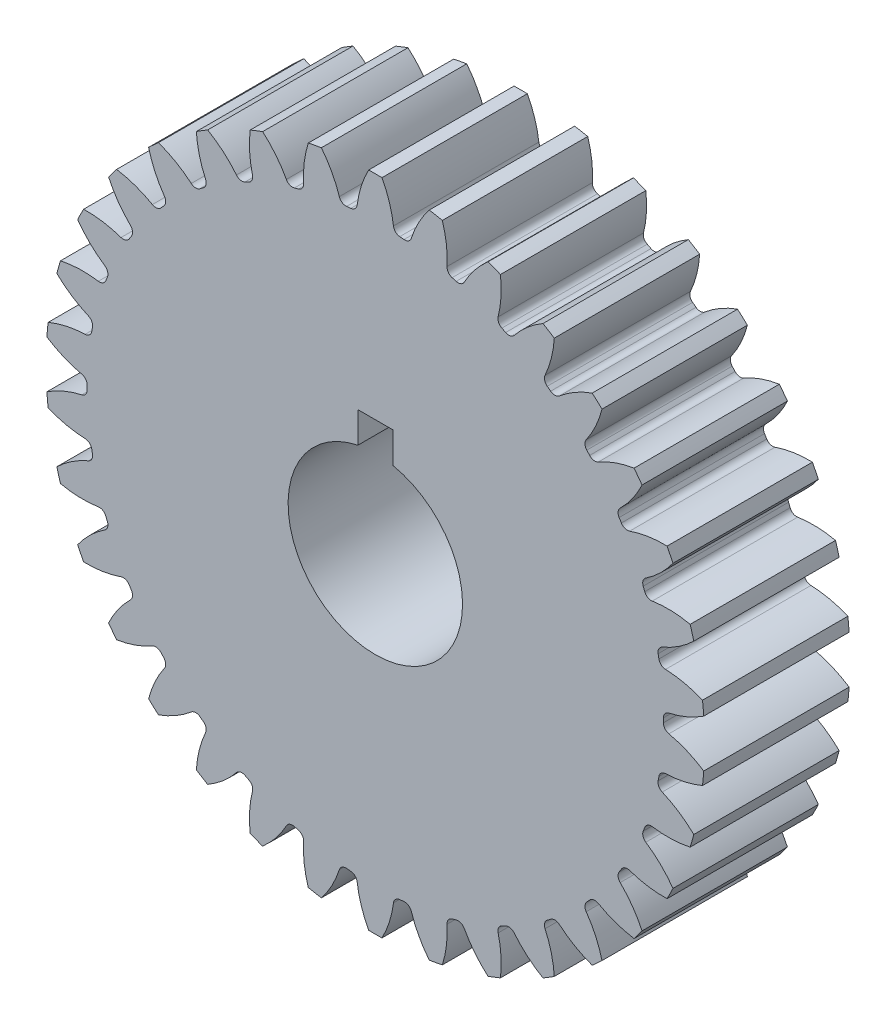
from build123d import *

# Parameters (mm, degrees)
BOSS_EXTRUDE1_DEPTH = 12.5
SKETCH2_R           = 15
CUT_EXTRUDE2_DEPTH  = 84.79598452
SKETCH3_W           = 6
SKETCH3_H           = 20
CUT_EXTRUDE3_DEPTH  = 84.79598452


with BuildPart() as part:
    # Sketch1 → Boss-Extrude1 (new, symmetric)
    with BuildSketch(Plane.XY):
        with BuildLine():
            ThreePointArc((4.20734432, 49.370549967), (3.481701344, 49.698584695), (3.123089937, 50.409613787))
            ThreePointArc((3.123089937, 50.409613787), (2.41504122, 53.603003225), (1.142985889, 56.616463747))
            ThreePointArc((1.142985889, 56.616463747), (0, 56.628), (-1.142985889, 56.616463747))
            ThreePointArc((-1.142985889, 56.616463747), (-2.41504122, 53.603003225), (-3.123089937, 50.409613787))
            ThreePointArc((-3.123089937, 50.409613787), (-3.481701344, 49.698584695), (-4.20734432, 49.370549967))
            ThreePointArc((-4.20734432, 49.370549967), (-4.571851077, 49.338130568), (-4.936108463, 49.303020024))
            ThreePointArc((-4.936108463, 49.303020024), (-5.709672211, 49.49213279), (-6.192828831, 50.125160588))
            ThreePointArc((-6.192828831, 50.125160588), (-7.475605442, 53.134072892), (-9.279723532, 55.862483969))
            ThreePointArc((-9.279723532, 55.862483969), (-10.405367695, 55.663800689), (-11.526772296, 55.442437757))
            ThreePointArc((-11.526772296, 55.442437757), (-12.22344655, 52.246547572), (-12.332655622, 48.977428048))
            ThreePointArc((-12.332655622, 48.977428048), (-12.554509736, 48.212610904), (-13.207521039, 47.756825044))
            ThreePointArc((-13.207521039, 47.756825044), (-13.559864327, 47.657979706), (-13.911467993, 47.556534867))
            ThreePointArc((-13.911467993, 47.556534867), (-14.706609728, 47.600285663), (-15.29785824, 48.133755163))
            ThreePointArc((-15.29785824, 48.133755163), (-17.111679327, 50.855725434), (-19.386423098, 53.206174299))
            ThreePointArc((-19.386423098, 53.206174299), (-20.456393073, 52.804037407), (-21.518028298, 52.380386044))
            ThreePointArc((-21.518028298, 52.380386044), (-21.615597068, 49.110898405), (-21.122247512, 45.877374739))
            ThreePointArc((-21.122247512, 45.877374739), (-21.199789357, 45.084814474), (-21.757931469, 44.516798722))
            ThreePointArc((-21.757931469, 44.516798722), (-22.08611266, 44.354893505), (-22.413089165, 44.190568953))
            ThreePointArc((-22.413089165, 44.190568953), (-23.202731288, 44.087467898), (-23.881937435, 44.503212437))
            ThreePointArc((-23.881937435, 44.503212437), (-26.165035496, 46.845547241), (-28.832941276, 48.737992176))
            ThreePointArc((-28.832941276, 48.737992176), (-29.810800519, 48.146095962), (-30.776513654, 47.534583109))
            ThreePointArc((-30.776513654, 47.534583109), (-30.271654353, 44.302836495), (-29.192546596, 41.215022457))
            ThreePointArc((-29.192546596, 41.215022457), (-29.123135577, 40.42170876), (-29.567401638, 39.760806212))
            ThreePointArc((-29.567401638, 39.760806212), (-29.860244915, 39.541354603), (-30.151459467, 39.319746213))
            ThreePointArc((-30.151459467, 39.319746213), (-30.908711664, 39.073304291), (-31.652745894, 39.357166187))
            ThreePointArc((-31.652745894, 39.357166187), (-34.327372762, 41.240100122), (-37.297588221, 42.610096185))
            ThreePointArc((-37.297588221, 42.610096185), (-38.150036908, 41.848596964), (-38.98694175, 41.070046957))
            ThreePointArc((-38.98694175, 41.070046957), (-37.896846756, 37.986094624), (-36.268728518, 35.149142017))
            ThreePointArc((-36.268728518, 35.149142017), (-36.054728345, 34.382090235), (-36.369989407, 33.650807134))
            ThreePointArc((-36.369989407, 33.650807134), (-36.617522344, 33.381282295), (-36.863057979, 33.109936676))
            ThreePointArc((-36.863057979, 33.109936676), (-37.562132934, 32.728546169), (-38.345658054, 32.870858846))
            ThreePointArc((-38.345658054, 32.870858846), (-41.32073252, 34.230270855), (-44.492110532, 35.031164474))
            ThreePointArc((-44.492110532, 35.031164474), (-45.190119546, 34.125994189), (-45.869716304, 33.206919613))
            ThreePointArc((-45.869716304, 33.206919613), (-44.231507495, 30.375781859), (-42.109822391, 27.886299703))
            ThreePointArc((-42.109822391, 27.886299703), (-41.758520581, 27.171630863), (-41.934040808, 26.394870179))
            ThreePointArc((-41.934040808, 26.394870179), (-42.127833967, 26.084450454), (-42.319329265, 25.772607955))
            ThreePointArc((-42.319329265, 25.772607955), (-42.936420819, 25.269256661), (-43.73275482, 25.265173831))
            ThreePointArc((-43.73275482, 25.265173831), (-46.90696429, 26.054770769), (-50.171507382, 26.259288471))
            ThreePointArc((-50.171507382, 26.259288471), (-50.691306863, 25.241271611), (-51.190452684, 24.21297045))
            ThreePointArc((-51.190452684, 24.21297045), (-49.059917295, 21.731058275), (-46.516916766, 19.673822898))
            ThreePointArc((-46.516916766, 19.673822898), (-46.040276483, 19.035874191), (-46.070078744, 18.240087577))
            ThreePointArc((-46.070078744, 18.240087577), (-46.203532731, 17.899343939), (-46.334466549, 17.557623982))
            ThreePointArc((-46.334466549, 17.557623982), (-46.848560388, 16.949452925), (-47.630585072, 16.799113624))
            ThreePointArc((-47.630585072, 16.799113624), (-50.895835651, 16.992006714), (-54.142373722, 16.593183894))
            ThreePointArc((-54.142373722, 16.593183894), (-54.466262522, 15.496987802), (-54.767959594, 14.394477618))
            ThreePointArc((-54.767959594, 14.394477618), (-52.217650454, 12.346309565), (-49.339933333, 10.79137765))
            ThreePointArc((-49.339933333, 10.79137765), (-48.754185989, 10.251873655), (-48.637255402, 9.464160669))
            ThreePointArc((-48.637255402, 9.464160669), (-48.705825603, 9.104696733), (-48.771739146, 8.744736182))
            ThreePointArc((-48.771739146, 8.744736182), (-49.165328423, 8.052455897), (-49.906412876, 7.760979751))
            ThreePointArc((-49.906412876, 7.760979751), (-53.151510371, 7.35060025), (-56.269486461, 6.362018341))
            ThreePointArc((-56.269486461, 6.362018341), (-56.386434935, 5.22497266), (-56.480409327, 4.085798116))
            ThreePointArc((-56.480409327, 4.085798116), (-53.597174154, 2.54112209), (-50.482737646, 1.54144498))
            ThreePointArc((-50.482737646, 1.54144498), (-49.807830165, 1.118757857), (-49.548148663, 0.36594312))
            ThreePointArc((-49.548148663, 0.36594312), (-49.5495, 0), (-49.548148663, -0.36594312))
            ThreePointArc((-49.548148663, -0.36594312), (-49.807830165, -1.118757857), (-50.482737646, -1.54144498))
            ThreePointArc((-50.482737646, -1.54144498), (-53.597174154, -2.54112209), (-56.480409327, -4.085798116))
            ThreePointArc((-56.480409327, -4.085798116), (-56.386434935, -5.22497266), (-56.269486461, -6.362018341))
            ThreePointArc((-56.269486461, -6.362018341), (-53.151510371, -7.35060025), (-49.906412876, -7.760979751))
            ThreePointArc((-49.906412876, -7.760979751), (-49.165328423, -8.052455897), (-48.771739146, -8.744736182))
            ThreePointArc((-48.771739146, -8.744736182), (-48.705825603, -9.104696733), (-48.637255402, -9.464160669))
            ThreePointArc((-48.637255402, -9.464160669), (-48.754185989, -10.251873655), (-49.339933333, -10.79137765))
            ThreePointArc((-49.339933333, -10.79137765), (-52.217650454, -12.346309565), (-54.767959594, -14.394477618))
            ThreePointArc((-54.767959594, -14.394477618), (-54.466262522, -15.496987802), (-54.142373722, -16.593183894))
            ThreePointArc((-54.142373722, -16.593183894), (-50.895835651, -16.992006714), (-47.630585072, -16.799113624))
            ThreePointArc((-47.630585072, -16.799113624), (-46.848560388, -16.949452925), (-46.334466549, -17.557623982))
            ThreePointArc((-46.334466549, -17.557623982), (-46.203532731, -17.899343939), (-46.070078744, -18.240087577))
            ThreePointArc((-46.070078744, -18.240087577), (-46.040276483, -19.035874191), (-46.516916766, -19.673822898))
            ThreePointArc((-46.516916766, -19.673822898), (-49.059917295, -21.731058275), (-51.190452684, -24.21297045))
            ThreePointArc((-51.190452684, -24.21297045), (-50.691306863, -25.241271611), (-50.171507382, -26.259288471))
            ThreePointArc((-50.171507382, -26.259288471), (-46.90696429, -26.054770769), (-43.73275482, -25.265173831))
            ThreePointArc((-43.73275482, -25.265173831), (-42.936420819, -25.269256661), (-42.319329265, -25.772607955))
            ThreePointArc((-42.319329265, -25.772607955), (-42.127833967, -26.084450454), (-41.934040808, -26.394870179))
            ThreePointArc((-41.934040808, -26.394870179), (-41.758520581, -27.171630863), (-42.109822391, -27.886299703))
            ThreePointArc((-42.109822391, -27.886299703), (-44.231507495, -30.375781859), (-45.869716304, -33.206919613))
            ThreePointArc((-45.869716304, -33.206919613), (-45.190119546, -34.125994189), (-44.492110532, -35.031164474))
            ThreePointArc((-44.492110532, -35.031164474), (-41.32073252, -34.230270855), (-38.345658054, -32.870858846))
            ThreePointArc((-38.345658054, -32.870858846), (-37.562132934, -32.728546169), (-36.863057979, -33.109936676))
            ThreePointArc((-36.863057979, -33.109936676), (-36.617522344, -33.381282295), (-36.369989407, -33.650807134))
            ThreePointArc((-36.369989407, -33.650807134), (-36.054728345, -34.382090235), (-36.268728518, -35.149142017))
            ThreePointArc((-36.268728518, -35.149142017), (-37.896846756, -37.986094624), (-38.98694175, -41.070046957))
            ThreePointArc((-38.98694175, -41.070046957), (-38.150036908, -41.848596964), (-37.297588221, -42.610096185))
            ThreePointArc((-37.297588221, -42.610096185), (-34.327372762, -41.240100122), (-31.652745894, -39.357166187))
            ThreePointArc((-31.652745894, -39.357166187), (-30.908711664, -39.073304291), (-30.151459467, -39.319746213))
            ThreePointArc((-30.151459467, -39.319746213), (-29.860244915, -39.541354603), (-29.567401638, -39.760806212))
            ThreePointArc((-29.567401638, -39.760806212), (-29.123135577, -40.42170876), (-29.192546596, -41.215022457))
            ThreePointArc((-29.192546596, -41.215022457), (-30.271654353, -44.302836495), (-30.776513654, -47.534583109))
            ThreePointArc((-30.776513654, -47.534583109), (-29.810800519, -48.146095962), (-28.832941276, -48.737992176))
            ThreePointArc((-28.832941276, -48.737992176), (-26.165035496, -46.845547241), (-23.881937435, -44.503212437))
            ThreePointArc((-23.881937435, -44.503212437), (-23.202731288, -44.087467898), (-22.413089165, -44.190568953))
            ThreePointArc((-22.413089165, -44.190568953), (-22.08611266, -44.354893505), (-21.757931469, -44.516798722))
            ThreePointArc((-21.757931469, -44.516798722), (-21.199789357, -45.084814474), (-21.122247512, -45.877374739))
            ThreePointArc((-21.122247512, -45.877374739), (-21.615597068, -49.110898405), (-21.518028298, -52.380386044))
            ThreePointArc((-21.518028298, -52.380386044), (-20.456393073, -52.804037407), (-19.386423098, -53.206174299))
            ThreePointArc((-19.386423098, -53.206174299), (-17.111679327, -50.855725434), (-15.29785824, -48.133755163))
            ThreePointArc((-15.29785824, -48.133755163), (-14.706609728, -47.600285663), (-13.911467993, -47.556534867))
            ThreePointArc((-13.911467993, -47.556534867), (-13.559864327, -47.657979706), (-13.207521039, -47.756825044))
            ThreePointArc((-13.207521039, -47.756825044), (-12.554509736, -48.212610904), (-12.332655622, -48.977428048))
            ThreePointArc((-12.332655622, -48.977428048), (-12.22344655, -52.246547572), (-11.526772296, -55.442437757))
            ThreePointArc((-11.526772296, -55.442437757), (-10.405367695, -55.663800689), (-9.279723532, -55.862483969))
            ThreePointArc((-9.279723532, -55.862483969), (-7.475605442, -53.134072892), (-6.192828831, -50.125160588))
            ThreePointArc((-6.192828831, -50.125160588), (-5.709672211, -49.49213279), (-4.936108463, -49.303020024))
            ThreePointArc((-4.936108463, -49.303020024), (-4.571851077, -49.338130568), (-4.20734432, -49.370549967))
            ThreePointArc((-4.20734432, -49.370549967), (-3.481701344, -49.698584695), (-3.123089937, -50.409613787))
            ThreePointArc((-3.123089937, -50.409613787), (-2.41504122, -53.603003225), (-1.142985889, -56.616463747))
            ThreePointArc((-1.142985889, -56.616463747), (0, -56.628), (1.142985889, -56.616463747))
            ThreePointArc((1.142985889, -56.616463747), (2.41504122, -53.603003225), (3.123089937, -50.409613787))
            ThreePointArc((3.123089937, -50.409613787), (3.481701344, -49.698584695), (4.20734432, -49.370549967))
            ThreePointArc((4.20734432, -49.370549967), (4.571851077, -49.338130568), (4.936108463, -49.303020024))
            ThreePointArc((4.936108463, -49.303020024), (5.709672211, -49.49213279), (6.192828831, -50.125160588))
            ThreePointArc((6.192828831, -50.125160588), (7.475605442, -53.134072892), (9.279723532, -55.862483969))
            ThreePointArc((9.279723532, -55.862483969), (10.405367695, -55.663800689), (11.526772296, -55.442437757))
            ThreePointArc((11.526772296, -55.442437757), (12.22344655, -52.246547572), (12.332655622, -48.977428048))
            ThreePointArc((12.332655622, -48.977428048), (12.554509736, -48.212610904), (13.207521039, -47.756825044))
            ThreePointArc((13.207521039, -47.756825044), (13.559864327, -47.657979706), (13.911467993, -47.556534867))
            ThreePointArc((13.911467993, -47.556534867), (14.706609728, -47.600285663), (15.29785824, -48.133755163))
            ThreePointArc((15.29785824, -48.133755163), (17.111679327, -50.855725434), (19.386423098, -53.206174299))
            ThreePointArc((19.386423098, -53.206174299), (20.456393073, -52.804037407), (21.518028298, -52.380386044))
            ThreePointArc((21.518028298, -52.380386044), (21.615597068, -49.110898405), (21.122247512, -45.877374739))
            ThreePointArc((21.122247512, -45.877374739), (21.199789357, -45.084814474), (21.757931469, -44.516798722))
            ThreePointArc((21.757931469, -44.516798722), (22.08611266, -44.354893505), (22.413089165, -44.190568953))
            ThreePointArc((22.413089165, -44.190568953), (23.202731288, -44.087467898), (23.881937435, -44.503212437))
            ThreePointArc((23.881937435, -44.503212437), (26.165035496, -46.845547241), (28.832941276, -48.737992176))
            ThreePointArc((28.832941276, -48.737992176), (29.810800519, -48.146095962), (30.776513654, -47.534583109))
            ThreePointArc((30.776513654, -47.534583109), (30.271654353, -44.302836495), (29.192546596, -41.215022457))
            ThreePointArc((29.192546596, -41.215022457), (29.123135577, -40.42170876), (29.567401638, -39.760806212))
            ThreePointArc((29.567401638, -39.760806212), (29.860244915, -39.541354603), (30.151459467, -39.319746213))
            ThreePointArc((30.151459467, -39.319746213), (30.908711664, -39.073304291), (31.652745894, -39.357166187))
            ThreePointArc((31.652745894, -39.357166187), (34.327372762, -41.240100122), (37.297588221, -42.610096185))
            ThreePointArc((37.297588221, -42.610096185), (38.150036908, -41.848596964), (38.98694175, -41.070046957))
            ThreePointArc((38.98694175, -41.070046957), (37.896846756, -37.986094624), (36.268728518, -35.149142017))
            ThreePointArc((36.268728518, -35.149142017), (36.054728345, -34.382090235), (36.369989407, -33.650807134))
            ThreePointArc((36.369989407, -33.650807134), (36.617522344, -33.381282295), (36.863057979, -33.109936676))
            ThreePointArc((36.863057979, -33.109936676), (37.562132934, -32.728546169), (38.345658054, -32.870858846))
            ThreePointArc((38.345658054, -32.870858846), (41.32073252, -34.230270855), (44.492110532, -35.031164474))
            ThreePointArc((44.492110532, -35.031164474), (45.190119546, -34.125994189), (45.869716304, -33.206919613))
            ThreePointArc((45.869716304, -33.206919613), (44.231507495, -30.375781859), (42.109822391, -27.886299703))
            ThreePointArc((42.109822391, -27.886299703), (41.758520581, -27.171630863), (41.934040808, -26.394870179))
            ThreePointArc((41.934040808, -26.394870179), (42.127833967, -26.084450454), (42.319329265, -25.772607955))
            ThreePointArc((42.319329265, -25.772607955), (42.936420819, -25.269256661), (43.73275482, -25.265173831))
            ThreePointArc((43.73275482, -25.265173831), (46.90696429, -26.054770769), (50.171507382, -26.259288471))
            ThreePointArc((50.171507382, -26.259288471), (50.691306863, -25.241271611), (51.190452684, -24.21297045))
            ThreePointArc((51.190452684, -24.21297045), (49.059917295, -21.731058275), (46.516916766, -19.673822898))
            ThreePointArc((46.516916766, -19.673822898), (46.040276483, -19.035874191), (46.070078744, -18.240087577))
            ThreePointArc((46.070078744, -18.240087577), (46.203532731, -17.899343939), (46.334466549, -17.557623982))
            ThreePointArc((46.334466549, -17.557623982), (46.848560388, -16.949452925), (47.630585072, -16.799113624))
            ThreePointArc((47.630585072, -16.799113624), (50.895835651, -16.992006714), (54.142373722, -16.593183894))
            ThreePointArc((54.142373722, -16.593183894), (54.466262522, -15.496987802), (54.767959594, -14.394477618))
            ThreePointArc((54.767959594, -14.394477618), (52.217650454, -12.346309565), (49.339933333, -10.79137765))
            ThreePointArc((49.339933333, -10.79137765), (48.754185989, -10.251873655), (48.637255402, -9.464160669))
            ThreePointArc((48.637255402, -9.464160669), (48.705825603, -9.104696733), (48.771739146, -8.744736182))
            ThreePointArc((48.771739146, -8.744736182), (49.165328423, -8.052455897), (49.906412876, -7.760979751))
            ThreePointArc((49.906412876, -7.760979751), (53.151510371, -7.35060025), (56.269486461, -6.362018341))
            ThreePointArc((56.269486461, -6.362018341), (56.386434935, -5.22497266), (56.480409327, -4.085798116))
            ThreePointArc((56.480409327, -4.085798116), (53.597174154, -2.54112209), (50.482737646, -1.54144498))
            ThreePointArc((50.482737646, -1.54144498), (49.807830165, -1.118757857), (49.548148663, -0.36594312))
            ThreePointArc((49.548148663, -0.36594312), (49.5495, 0), (49.548148663, 0.36594312))
            ThreePointArc((49.548148663, 0.36594312), (49.807830165, 1.118757857), (50.482737646, 1.54144498))
            ThreePointArc((50.482737646, 1.54144498), (53.597174154, 2.54112209), (56.480409327, 4.085798116))
            ThreePointArc((56.480409327, 4.085798116), (56.386434935, 5.22497266), (56.269486461, 6.362018341))
            ThreePointArc((56.269486461, 6.362018341), (53.151510371, 7.35060025), (49.906412876, 7.760979751))
            ThreePointArc((49.906412876, 7.760979751), (49.165328423, 8.052455897), (48.771739146, 8.744736182))
            ThreePointArc((48.771739146, 8.744736182), (48.705825603, 9.104696733), (48.637255402, 9.464160669))
            ThreePointArc((48.637255402, 9.464160669), (48.754185989, 10.251873655), (49.339933333, 10.79137765))
            ThreePointArc((49.339933333, 10.79137765), (52.217650454, 12.346309565), (54.767959594, 14.394477618))
            ThreePointArc((54.767959594, 14.394477618), (54.466262522, 15.496987802), (54.142373722, 16.593183894))
            ThreePointArc((54.142373722, 16.593183894), (50.895835651, 16.992006714), (47.630585072, 16.799113624))
            ThreePointArc((47.630585072, 16.799113624), (46.848560388, 16.949452925), (46.334466549, 17.557623982))
            ThreePointArc((46.334466549, 17.557623982), (46.203532731, 17.899343939), (46.070078744, 18.240087577))
            ThreePointArc((46.070078744, 18.240087577), (46.040276483, 19.035874191), (46.516916766, 19.673822898))
            ThreePointArc((46.516916766, 19.673822898), (49.059917295, 21.731058275), (51.190452684, 24.21297045))
            ThreePointArc((51.190452684, 24.21297045), (50.691306863, 25.241271611), (50.171507382, 26.259288471))
            ThreePointArc((50.171507382, 26.259288471), (46.90696429, 26.054770769), (43.73275482, 25.265173831))
            ThreePointArc((43.73275482, 25.265173831), (42.936420819, 25.269256661), (42.319329265, 25.772607955))
            ThreePointArc((42.319329265, 25.772607955), (42.127833967, 26.084450454), (41.934040808, 26.394870179))
            ThreePointArc((41.934040808, 26.394870179), (41.758520581, 27.171630863), (42.109822391, 27.886299703))
            ThreePointArc((42.109822391, 27.886299703), (44.231507495, 30.375781859), (45.869716304, 33.206919613))
            ThreePointArc((45.869716304, 33.206919613), (45.190119546, 34.125994189), (44.492110532, 35.031164474))
            ThreePointArc((44.492110532, 35.031164474), (41.32073252, 34.230270855), (38.345658054, 32.870858846))
            ThreePointArc((38.345658054, 32.870858846), (37.562132934, 32.728546169), (36.863057979, 33.109936676))
            ThreePointArc((36.863057979, 33.109936676), (36.617522344, 33.381282295), (36.369989407, 33.650807134))
            ThreePointArc((36.369989407, 33.650807134), (36.054728345, 34.382090235), (36.268728518, 35.149142017))
            ThreePointArc((36.268728518, 35.149142017), (37.896846756, 37.986094624), (38.98694175, 41.070046957))
            ThreePointArc((38.98694175, 41.070046957), (38.150036908, 41.848596964), (37.297588221, 42.610096185))
            ThreePointArc((37.297588221, 42.610096185), (34.327372762, 41.240100122), (31.652745894, 39.357166187))
            ThreePointArc((31.652745894, 39.357166187), (30.908711664, 39.073304291), (30.151459467, 39.319746213))
            ThreePointArc((30.151459467, 39.319746213), (29.860244915, 39.541354603), (29.567401638, 39.760806212))
            ThreePointArc((29.567401638, 39.760806212), (29.123135577, 40.42170876), (29.192546596, 41.215022457))
            ThreePointArc((29.192546596, 41.215022457), (30.271654353, 44.302836495), (30.776513654, 47.534583109))
            ThreePointArc((30.776513654, 47.534583109), (29.810800519, 48.146095962), (28.832941276, 48.737992176))
            ThreePointArc((28.832941276, 48.737992176), (26.165035496, 46.845547241), (23.881937435, 44.503212437))
            ThreePointArc((23.881937435, 44.503212437), (23.202731288, 44.087467898), (22.413089165, 44.190568953))
            ThreePointArc((22.413089165, 44.190568953), (22.08611266, 44.354893505), (21.757931469, 44.516798722))
            ThreePointArc((21.757931469, 44.516798722), (21.199789357, 45.084814474), (21.122247512, 45.877374739))
            ThreePointArc((21.122247512, 45.877374739), (21.615597068, 49.110898405), (21.518028298, 52.380386044))
            ThreePointArc((21.518028298, 52.380386044), (20.456393073, 52.804037407), (19.386423098, 53.206174299))
            ThreePointArc((19.386423098, 53.206174299), (17.111679327, 50.855725434), (15.29785824, 48.133755163))
            ThreePointArc((15.29785824, 48.133755163), (14.706609728, 47.600285663), (13.911467993, 47.556534867))
            ThreePointArc((13.911467993, 47.556534867), (13.559864327, 47.657979706), (13.207521039, 47.756825044))
            ThreePointArc((13.207521039, 47.756825044), (12.554509736, 48.212610904), (12.332655622, 48.977428048))
            ThreePointArc((12.332655622, 48.977428048), (12.22344655, 52.246547572), (11.526772296, 55.442437757))
            ThreePointArc((11.526772296, 55.442437757), (10.405367695, 55.663800689), (9.279723532, 55.862483969))
            ThreePointArc((9.279723532, 55.862483969), (7.475605442, 53.134072892), (6.192828831, 50.125160588))
            ThreePointArc((6.192828831, 50.125160588), (5.709672211, 49.49213279), (4.936108463, 49.303020024))
            ThreePointArc((4.936108463, 49.303020024), (4.571851077, 49.338130568), (4.20734432, 49.370549967))
        make_face()
    extrude(amount=BOSS_EXTRUDE1_DEPTH, both=True)

    # Sketch2 → Cut-Extrude2 (cut, through all)
    with BuildSketch(Plane(origin=(0, 0, -12.5), x_dir=(-1, 0, 0), z_dir=(0, 0, -1))):
        Circle(SKETCH2_R)
    extrude(amount=-CUT_EXTRUDE2_DEPTH, mode=Mode.SUBTRACT)

    # Sketch3 → Cut-Extrude3 (cut, through all)
    with BuildSketch(Plane.XY.offset(12.5)):
        with Locations((0, 10)):
            Rectangle(SKETCH3_W, SKETCH3_H)
    extrude(amount=-CUT_EXTRUDE3_DEPTH, mode=Mode.SUBTRACT)


solid = part.part
